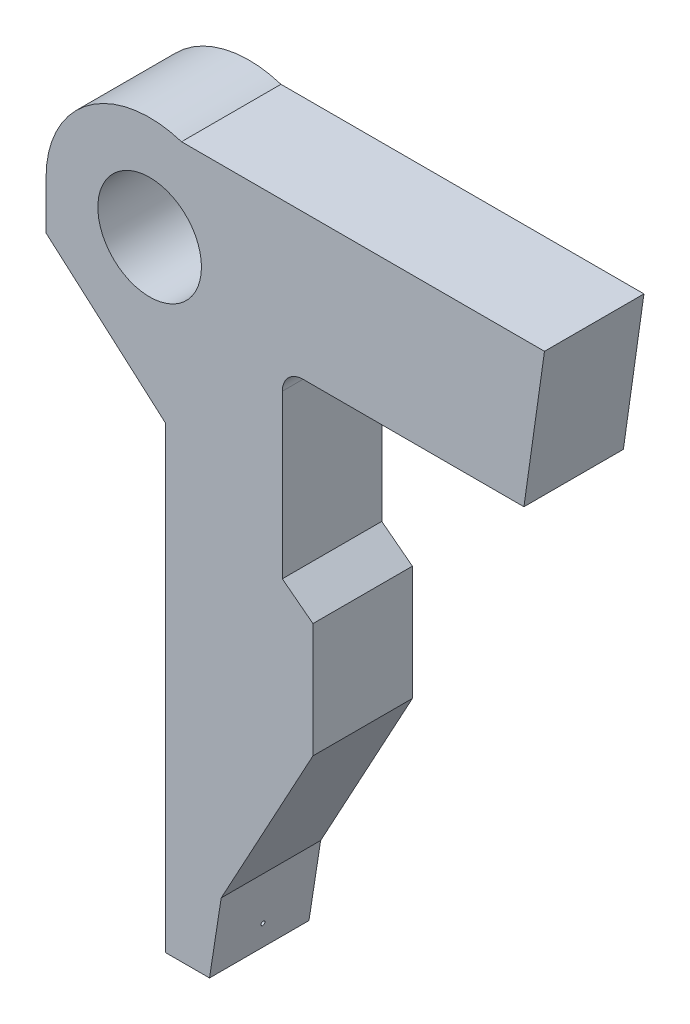
from build123d import *

# Parameters (mm, degrees)
SKETCH_1_R          = 5
SKETCH_1_R_2        = 2.5
EXTRUDE_1_DEPTH     = 4.8
SKETCH_3_R          = 1.825
CUT_EXTRUDE_1_DEPTH = 2
CUT_EXTRUDE_2_REACH = 36.062
SKETCH_4_R          = 0.1


with BuildPart() as part:
    # 스케치1 → 보스-돌출1 (new body)
    # profile 1 of 2: a face of its own
    with BuildSketch(Plane.XY):
        with BuildLine():
            ThreePointArc((5, 0), (0, -5), (-5, 0))
            Line((-5, 0), (-5, -2.326474397))
            Line((-5, -2.326474397), (0.754164722, -7.377840375))
            Line((0.754164722, -7.377840375), (0.754164722, -29.519890116))
            Line((0.754164722, -29.519890116), (2.889052882, -29.519890116))
            Line((2.889052882, -29.519890116), (3.452626944, -25.890848407))
            Line((3.452626944, -25.890848407), (7.880357437, -17.740939791))
            Line((7.880357437, -17.740939791), (7.880357437, -12.211059606))
            Line((7.880357437, -12.211059606), (6.40208237, -11.079255258))
            Line((6.40208237, -11.079255258), (6.40208237, -3.237610212))
            ThreePointArc((6.40208237, -3.237610212), (6.694975589, -2.530503431), (7.40208237, -2.237610212))
            Line((7.40208237, -2.237610212), (18.063612226, -2.237610212))
            Line((18.063612226, -2.237610212), (19.056002599, 4.757997197))
            Line((19.056002599, 4.757997197), (1.536705134, 4.757997197))
            ThreePointArc((1.536705134, 4.757997197), (4.04249463, 2.942488261), (5, 0))
        make_face()
    # profile 2 of 2: a face of its own
    with BuildSketch(Plane.XY):
        Circle(SKETCH_1_R)
        Circle(SKETCH_1_R_2, mode=Mode.SUBTRACT)
    extrude(amount=EXTRUDE_1_DEPTH)

    # 스케치3 → 컷-돌출1 (cut)
    with BuildSketch(Plane.ZY.offset(-0.754164722)):
        with Locations((2.4, -27.019890116)):
            Circle(SKETCH_3_R)
    extrude(amount=-CUT_EXTRUDE_1_DEPTH, mode=Mode.SUBTRACT)

    # 컷-돌출2: up to this plane
    cut_extrude_2_end = Plane(origin=(7.297372122, -1.133249487, 4.8), z_dir=(-0.9881554576984991, 0.15345615471746255, 0))
    # 스케치4 → 컷-돌출2 (cut, up to the surface)
    with BuildSketch(Plane.ZY.offset(-2.754164722), mode=Mode.PRIVATE) as cut_extrude_2_sk1:
        with Locations((2.4, -28.344890116)):
            Circle(SKETCH_4_R)
    cut_extrude_2_tool1 = split(extrude(cut_extrude_2_sk1.sketch, amount=-CUT_EXTRUDE_2_REACH, mode=Mode.PRIVATE), bisect_by=cut_extrude_2_end, keep=Keep.BOTH, mode=Mode.PRIVATE)
    add(cut_extrude_2_tool1.solids().sort_by_distance((2.754165, -28.34489, 2.4))[0], mode=Mode.SUBTRACT)


solid = part.part
